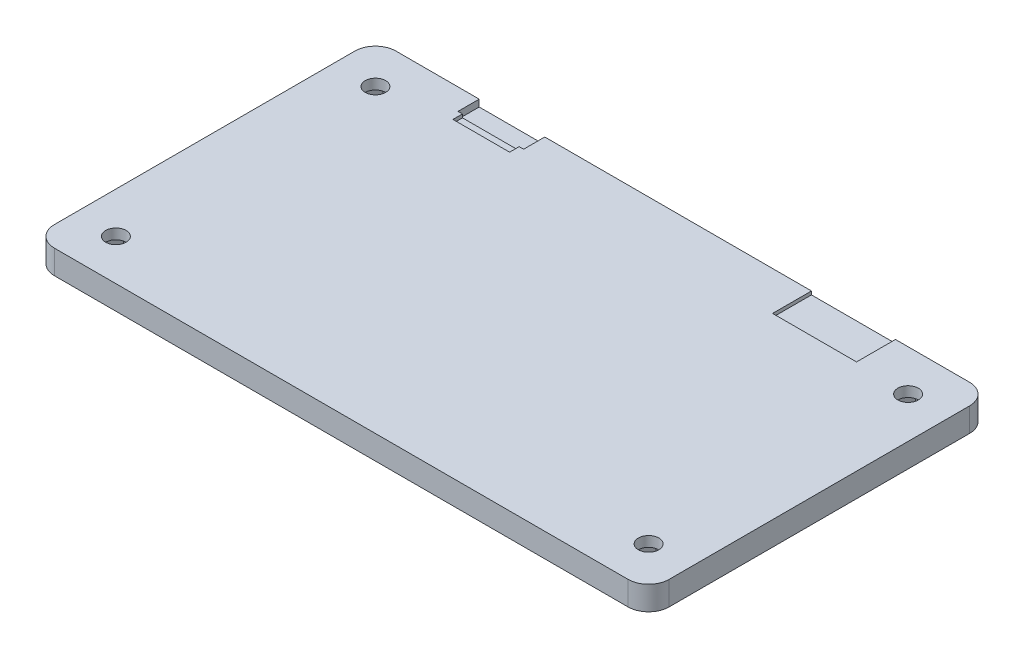
from build123d import *

# Parameters (mm, degrees)
SKETCH_1_R          = 1.5
EXTRUDE_1_DEPTH     = 3.5
SKETCH_2_W          = 8.3
SKETCH_2_H          = 1.4
SKETCH_2_W_2        = 12.3
SKETCH_2_H_2        = 5.7
CUT_EXTRUDE_1_DEPTH = 0.5
SKETCH_2_3_W        = 9.6
SKETCH_2_3_H        = 3.1
CUT_EXTRUDE_2_DEPTH = 1
CUT_EXTRUDE_3_DEPTH = 2


with BuildPart() as part:
    # 草图1 → 凸台-拉伸1 (new body)
    with BuildSketch(Plane(origin=(0, 0, 0), x_dir=(1, 0, 0), z_dir=(0, 1, 0))):
        with BuildLine():
            Line((-42, -25), (42, -25))
            ThreePointArc((42, -25), (44.121320344, -24.121320344), (45, -22))
            Line((45, -22), (45, 22))
            ThreePointArc((45, 22), (44.121320344, 24.121320344), (42, 25))
            Line((42, 25), (-42, 25))
            ThreePointArc((-42, 25), (-44.121320344, 24.121320344), (-45, 22))
            Line((-45, 22), (-45, -22))
            ThreePointArc((-45, -22), (-44.121320344, -24.121320344), (-42, -25))
        make_face()
        with Locations((-39, 19)):
            Circle(SKETCH_1_R, mode=Mode.SUBTRACT)
        with Locations((39, 19)):
            Circle(SKETCH_1_R, mode=Mode.SUBTRACT)
        with Locations((-39, -19)):
            Circle(SKETCH_1_R, mode=Mode.SUBTRACT)
        with Locations((39, -19)):
            Circle(SKETCH_1_R, mode=Mode.SUBTRACT)
    extrude(amount=EXTRUDE_1_DEPTH)

    # 草图2 → 切除-拉伸1 (cut)
    with BuildSketch(Plane(origin=(0, 3.5, 0), x_dir=(1, 0, 0), z_dir=(0, 1, 0))):
        with Locations((-25, 21.2)):
            Rectangle(SKETCH_2_W, SKETCH_2_H)
        with Locations((25, 22.15)):
            Rectangle(SKETCH_2_W_2, SKETCH_2_H_2)
    extrude(amount=-CUT_EXTRUDE_1_DEPTH, mode=Mode.SUBTRACT)

    # 草图2<3> → 切除-拉伸2 (cut)
    with BuildSketch(Plane(origin=(0, 3.5, 0), x_dir=(1, 0, 0), z_dir=(0, 1, 0))):
        with Locations((-25, 23.45)):
            Rectangle(SKETCH_2_3_W, SKETCH_2_3_H)
    extrude(amount=-CUT_EXTRUDE_2_DEPTH, mode=Mode.SUBTRACT)

    # 草图3 → 切除-拉伸3 (cut)
    with BuildSketch(Plane.XZ):
        Polygon((-37.4988893, 21.6), (-40.5011107, 21.6), (-42.0022214, 19), (-40.5011107, 16.4), (-37.4988893, 16.4), (-35.9977786, 19), align=None)
        Polygon((-37.4988893, -16.4), (-40.5011107, -16.4), (-42.0022214, -19), (-40.5011107, -21.6), (-37.4988893, -21.6), (-35.9977786, -19), align=None)
        Polygon((40.5011107, -16.4), (37.4988893, -16.4), (35.9977786, -19), (37.4988893, -21.6), (40.5011107, -21.6), (42.0022214, -19), align=None)
        Polygon((37.4988893, 21.6), (35.9977786, 19), (37.4988893, 16.4), (40.5011107, 16.4), (42.0022214, 19), (40.5011107, 21.6), align=None)
    extrude(amount=-CUT_EXTRUDE_3_DEPTH, mode=Mode.SUBTRACT)


solid = part.part
